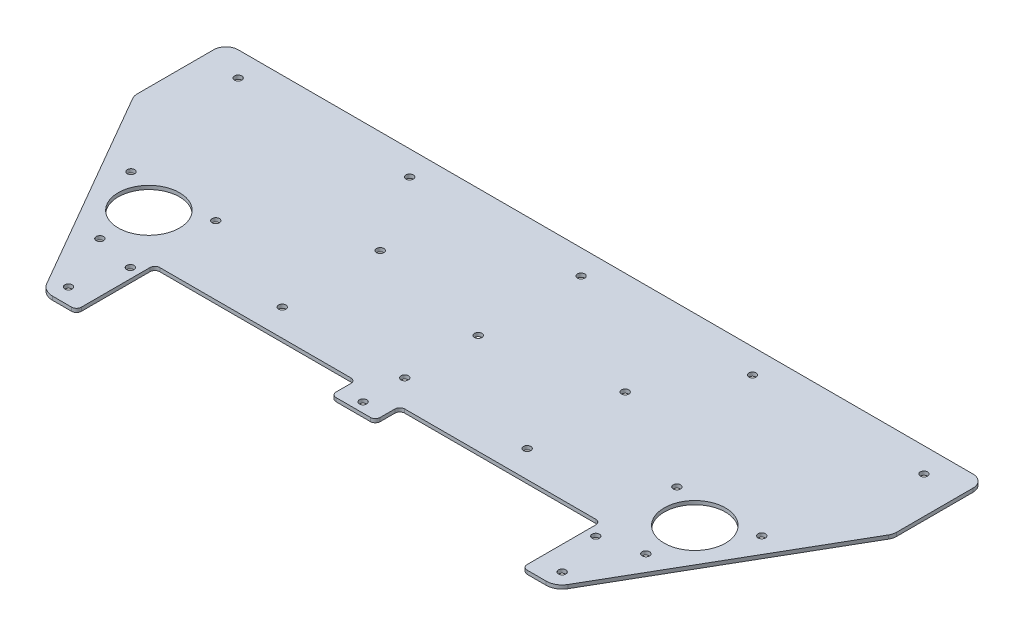
from build123d import *

# Parameters (mm, degrees)
ESQUISSE1_R             = 1.5
ESQUISSE1_R_2           = 12.5
BOSS_EXTRU_1_DEPTH      = 1.5
CONG_2_R                = 5
ESQUISSE2_R             = 1.5
ESQUISSE2_W             = 182
ESQUISSE2_H             = 32
ENL_V_MAT_EXTRU_1_DEPTH = 223.771744169
ESQUISSE3_W             = 18
ESQUISSE3_H             = 10
BOSS_EXTRU_2_DEPTH      = 1.5
CONG_3_R                = 2
ESQUISSE4_R             = 1.5
ENL_V_MAT_EXTRU_2_DEPTH = 3


with BuildPart() as part:
    # Esquisse1 → Boss.-Extru.1 (new body)
    with BuildSketch(Plane(origin=(0, 0, 0), x_dir=(1, 0, 0), z_dir=(0, 1, 0))):
        with BuildLine():
            Line((-155, -35), (155, -35))
            Line((155, -35), (155, -72.562177826))
            Line((155, -72.562177826), (106.394138206, -156.75))
            ThreePointArc((106.394138206, -156.75), (104.014973081, -159.129165125), (100.764973081, -160))
            Line((100.764973081, -160), (-100.764973081, -160))
            ThreePointArc((-100.764973081, -160), (-104.014973081, -159.129165125), (-106.394138206, -156.75))
            Line((-106.394138206, -156.75), (-155, -72.562177826))
            Line((-155, -72.562177826), (-155, -35))
        make_face()
        with Locations(Location((-70, -45, 0), (0, 0, 270))):
            Circle(ESQUISSE1_R, mode=Mode.SUBTRACT)
        with Locations(Location((0, -45, 0), (0, 0, 270))):
            Circle(ESQUISSE1_R, mode=Mode.SUBTRACT)
        with Locations(Location((111.445953061, -110, 0), (0, 0, 270))):
            Circle(ESQUISSE1_R_2, mode=Mode.SUBTRACT)
        with Locations(Location((128.766461137, -100, 0), (0, 0, 270))):
            Circle(ESQUISSE1_R, mode=Mode.SUBTRACT)
        with Locations(Location((94.125444985, -100, 0), (0, 0, 270))):
            Circle(ESQUISSE1_R, mode=Mode.SUBTRACT)
        with Locations(Location((111.445953061, -130, 0), (0, 0, 270))):
            Circle(ESQUISSE1_R, mode=Mode.SUBTRACT)
        with Locations(Location((70, -45, 0), (0, 0, 90))):
            Circle(ESQUISSE1_R, mode=Mode.SUBTRACT)
        with Locations(Location((-140, -45, 0), (0, 0, 270))):
            Circle(ESQUISSE1_R, mode=Mode.SUBTRACT)
        with Locations(Location((140, -45, 0), (0, 0, 90))):
            Circle(ESQUISSE1_R, mode=Mode.SUBTRACT)
        with Locations(Location((-100.764973081, -153.5, 0), (0, 0, 270))):
            Circle(ESQUISSE1_R, mode=Mode.SUBTRACT)
        with Locations(Location((100.764973081, -153.5, 0), (0, 0, 90))):
            Circle(ESQUISSE1_R, mode=Mode.SUBTRACT)
        with Locations(Location((-111.445953061, -130, 0), (0, 0, 90))):
            Circle(ESQUISSE1_R, mode=Mode.SUBTRACT)
        with Locations(Location((-128.766461137, -100, 0), (0, 0, 90))):
            Circle(ESQUISSE1_R, mode=Mode.SUBTRACT)
        with Locations(Location((-111.445953061, -110, 0), (0, 0, 90))):
            Circle(ESQUISSE1_R_2, mode=Mode.SUBTRACT)
        with Locations(Location((-94.125444985, -100, 0), (0, 0, 90))):
            Circle(ESQUISSE1_R, mode=Mode.SUBTRACT)
    extrude(amount=BOSS_EXTRU_1_DEPTH)

    # Congé2
    cong_2_edges = [part.edges().sort_by_distance(p)[0] for p in [
        (-155, 0.75, 35),
        (155, 0.75, 35),
        (155, 0.75, 72.562177826),
        (-155, 0.75, 72.562177826),
    ]]
    fillet(cong_2_edges, radius=CONG_2_R)

    # Esquisse2 → Enlèv. mat.-Extru.1 (cut, through all)
    with BuildSketch(Plane(origin=(0, 1.5, 0), x_dir=(1, 0, 0), z_dir=(0, 1, 0))):
        with Locations(Location((-50, -77, 0), (0, 0, 270))):
            Circle(ESQUISSE2_R)
        with Locations(Location((-50, -117, 0), (0, 0, 270))):
            Circle(ESQUISSE2_R)
        with Locations(Location((50, -117, 0), (0, 0, 90))):
            Circle(ESQUISSE2_R)
        with Locations(Location((50, -77, 0), (0, 0, 90))):
            Circle(ESQUISSE2_R)
        with Locations(Location((0, -117, 0), (0, 0, 270))):
            Circle(ESQUISSE2_R)
        with Locations(Location((0, -87, 0), (0, 0, 270))):
            Circle(ESQUISSE2_R)
        with Locations((0, -144)):
            Rectangle(ESQUISSE2_W, ESQUISSE2_H)
    extrude(amount=-ENL_V_MAT_EXTRU_1_DEPTH, mode=Mode.SUBTRACT)

    # Esquisse3 → Boss.-Extru.2 (add)
    with BuildSketch(Plane(origin=(0, 1.5, 0), x_dir=(1, 0, 0), z_dir=(0, 1, 0))):
        with Locations((0, -133)):
            Rectangle(ESQUISSE3_W, ESQUISSE3_H)
    extrude(amount=-BOSS_EXTRU_2_DEPTH)

    # Congé3
    cong_3_edges = [part.edges().sort_by_distance(p)[0] for p in [
        (-91, 0.75, 160),
        (-91, 0.75, 128),
        (91, 0.75, 128),
        (91, 0.75, 160),
        (-9, 0.75, 138),
        (-9, 0.75, 128),
        (9, 0.75, 128),
        (9, 0.75, 138),
    ]]
    fillet(cong_3_edges, radius=CONG_3_R)

    # Esquisse4 → Enlèv. mat.-Extru.2 (cut)
    with BuildSketch(Plane(origin=(0, 1.5, 0), x_dir=(1, 0, 0), z_dir=(0, 1, 0))):
        with Locations(Location((-95, -134, 0), (0, 0, 270))):
            Circle(ESQUISSE4_R)
        with Locations(Location((0, -134, 0), (0, 0, 270))):
            Circle(ESQUISSE4_R)
        with Locations(Location((95, -134, 0), (0, 0, 270))):
            Circle(ESQUISSE4_R)
    extrude(amount=-ENL_V_MAT_EXTRU_2_DEPTH, mode=Mode.SUBTRACT)


solid = part.part
